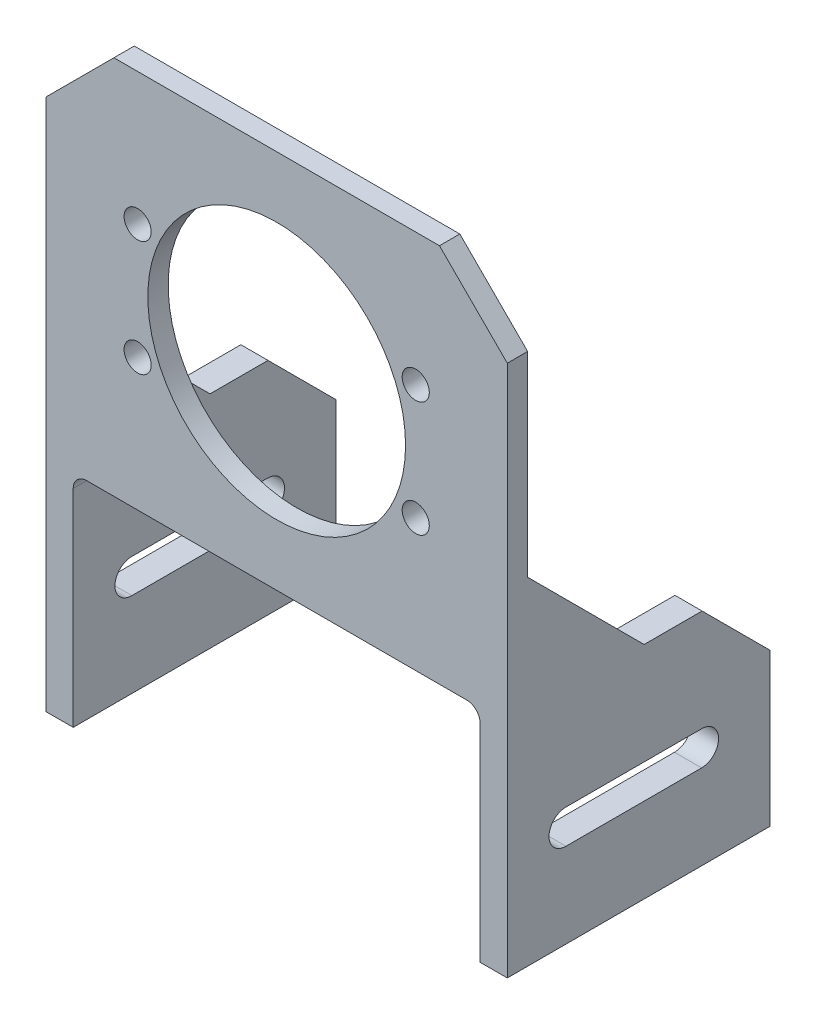
from build123d import *

# Parameters (mm, degrees)
SKETCH_1_R             = 2
SKETCH_1_R_2           = 19
EXTRUDE_1_DEPTH        = 3
EXTRUDE_2_DEPTH        = 4
FILLET_3_R             = 2
FILLET_4_R             = 2
FILLET_3_OF_MIRROR_1_R = 2
FILLET_4_OF_MIRROR_1_R = 2
RIB_1_REACH            = 99.776
SKETCH_4_WALL_W        = 221.83912235
SKETCH_4_WALL_H        = 4


with BuildPart() as part:
    # 草图1 → 凸台-拉伸1 (new body)
    with BuildSketch(Plane.XY):
        Polygon((-24, 28), (24, 28), (34, 18), (34, -28), (-34, -28), (-34, 18), align=None)
        with Locations((20.5, -8.5)):
            Circle(SKETCH_1_R, mode=Mode.SUBTRACT)
        with Locations((20.5, 8.5)):
            Circle(SKETCH_1_R, mode=Mode.SUBTRACT)
        with Locations((-20.5, -8.5)):
            Circle(SKETCH_1_R, mode=Mode.SUBTRACT)
        with Locations((-20.5, 8.5)):
            Circle(SKETCH_1_R, mode=Mode.SUBTRACT)
        Circle(SKETCH_1_R_2, mode=Mode.SUBTRACT)
    extrude(amount=EXTRUDE_1_DEPTH)

    # 草图3 → 凸台-拉伸2 (add)
    with BuildSketch(Plane(origin=(34, 0, 0), x_dir=(0, 0, -1), z_dir=(1, 0, 0))):
        Polygon((-3, -28), (-3, -60.5), (35.720694049, -60.5), (35.720694049, -38), (25.720694049, -28), align=None)
        with BuildLine():
            Line((5.647014868, -43), (25.647014868, -43))
            ThreePointArc((25.647014868, -43), (28.147014868, -45.5), (25.647014868, -48))
            Line((25.647014868, -48), (5.647014868, -48))
            ThreePointArc((5.647014868, -48), (3.147014868, -45.5), (5.647014868, -43))
        make_face(mode=Mode.SUBTRACT)
    extrude_2 = extrude(amount=-EXTRUDE_2_DEPTH)

    # 圆角3
    fillet_3_edges = [part.edges().sort_by_distance(p)[0] for p in [
        (32, -28, 0),
    ]]
    fillet(fillet_3_edges, radius=FILLET_3_R)

    # 圆角4
    fillet_4_edges = [part.edges().sort_by_distance(p)[0] for p in [
        (30, -28, 1.5),
        (30, -27, 0),
    ]]
    fillet(fillet_4_edges, radius=FILLET_4_R)

    # 镜向1: 凸台-拉伸2 across plane
    add(extrude_2.mirror(Plane(origin=(0, 0, 0), x_dir=(0, 0, 1), z_dir=(1, 0, 0))))

    # 圆角3 of 镜向1
    fillet_3_of_mirror_1_edges = [part.edges().sort_by_distance(p)[0] for p in [
        (-32, -28, 0),
    ]]
    fillet(fillet_3_of_mirror_1_edges, radius=FILLET_3_OF_MIRROR_1_R)

    # 圆角4 of 镜向1
    fillet_4_of_mirror_1_edges = [part.edges().sort_by_distance(p)[0] for p in [
        (-30, -28, 1.5),
        (-30, -27, 0),
    ]]
    fillet(fillet_4_of_mirror_1_edges, radius=FILLET_4_OF_MIRROR_1_R)

    # 草图4 wall → 筋1 (add, up to next)
    with BuildSketch(Plane(origin=(34, -19.413465197, -8.586534803), x_dir=(0, -0.707106781187, -0.707106781187), z_dir=(0, 0.707106781187, -0.707106781187)), mode=Mode.PRIVATE) as rib_1_sk1:
        with Locations((0, 2)):
            Rectangle(SKETCH_4_WALL_W, SKETCH_4_WALL_H)
    rib_1_tool1 = extrude(rib_1_sk1.sketch, amount=-RIB_1_REACH, mode=Mode.PRIVATE) - part.part
    rib_1 = rib_1_tool1.solids().sort_by_distance((34, -19.413465197, -8.586534803))[0]
    add(rib_1)

    # 镜向2: 筋1 across plane
    add(rib_1.mirror(Plane(origin=(0, 0, 0), x_dir=(0, 0, 1), z_dir=(1, 0, 0))))


solid = part.part
